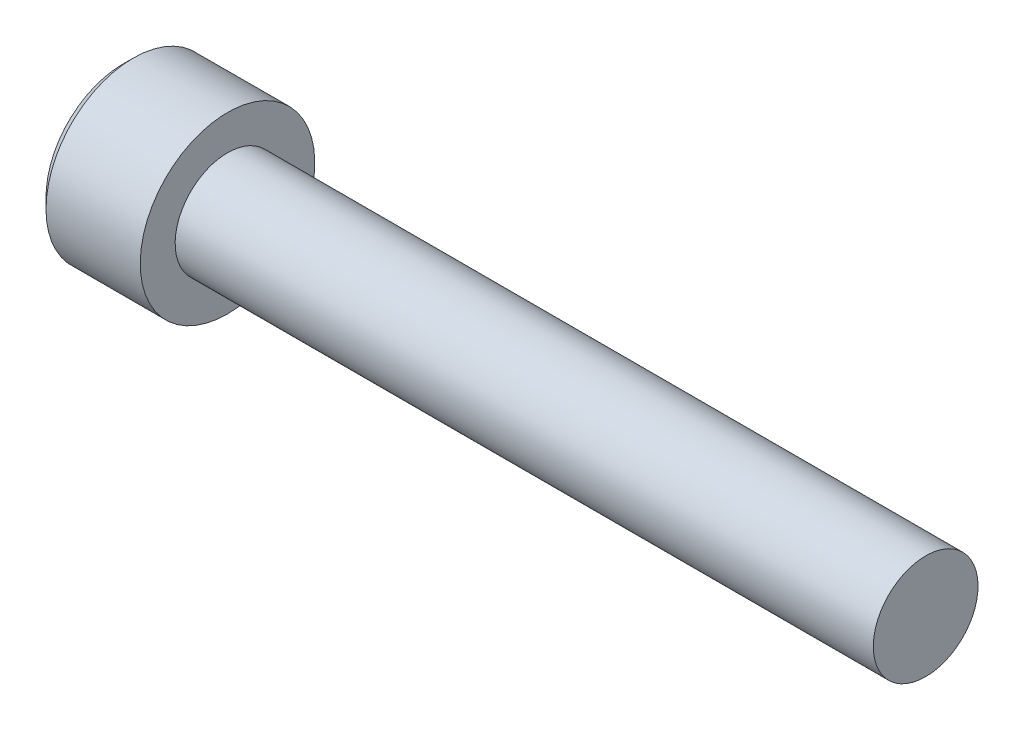
from build123d import *

# Parameters (mm, degrees)
CUT_EXTRUDE1_DEPTH = 3
CHAMFER1_SIZE      = 0.6


with BuildPart() as part:
    # Sketch1 → Revolve1 (revolve)
    with BuildSketch(Plane.XY, mode=Mode.PRIVATE) as revolve1_sk:
        Polygon((0, 3), (40, 3), (40, 0), (-6, 0), (-6, 5), (0, 5), align=None)
    revolve(revolve1_sk.sketch.rotate(Axis((-6, 0, 0), (1, 0, 0)), 180), axis=Axis((-6, 0, 0), (1, 0, 0)))

    # Sketch2 → Cut-Revolve1 (revolve, cut)
    with BuildSketch(Plane.XY, mode=Mode.PRIVATE) as cut_revolve1_sk:
        Polygon((-6, 2.5), (-3, 2.5), (-1.497848452, 0), (-6, 0), align=None)
    revolve(cut_revolve1_sk.sketch.rotate(Axis((-1.497848452, 0, 0), (-1, 0, 0)), 90), axis=Axis((-1.497848452, 0, 0), (-1, 0, 0)), mode=Mode.SUBTRACT)

    # Sketch3 → Cut-Extrude1 (cut)
    with BuildSketch(Plane.ZY.offset(6)):
        Polygon((2.5, 1.443375673), (0, 2.886751346), (-2.5, 1.443375673), (-2.5, -1.443375673), (0, -2.886751346), (2.5, -1.443375673), align=None)
    extrude(amount=-CUT_EXTRUDE1_DEPTH, mode=Mode.SUBTRACT)

    # Chamfer1
    chamfer1_edges = [part.edges().sort_by_distance(p)[0] for p in [
        (-6, 5, 0),
    ]]
    chamfer(chamfer1_edges, length=CHAMFER1_SIZE)


solid = part.part
